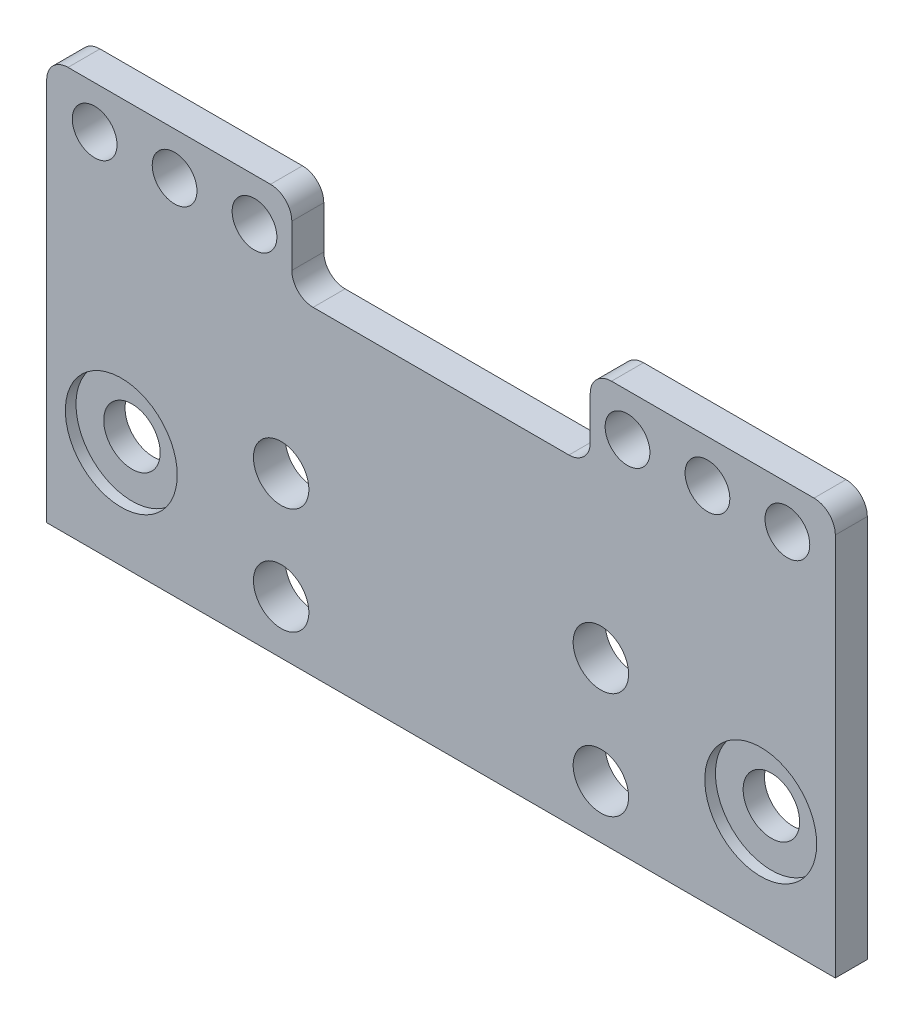
from build123d import *

# Parameters (mm, degrees)
SKETCH_1_R          = 2.1
SKETCH_1_R_2        = 2.65
SKETCH_1_R_3        = 2.6
EXTRUDE_1_DEPTH     = 3
FILLET_1_R          = 2
SKETCH_2_R          = 5.25
CUT_EXTRUDE_1_DEPTH = 1


with BuildPart() as part:
    # 草图1 → 凸台-拉伸1 (new body)
    with BuildSketch(Plane.XY):
        Polygon((14, 20), (14, 28), (37, 28), (37, -10), (-37, -10), (-37, 28), (-14, 28), (-14, 20), align=None)
        with Locations((17.5, 24)):
            Circle(SKETCH_1_R, mode=Mode.SUBTRACT)
        with Locations((25, 24)):
            Circle(SKETCH_1_R, mode=Mode.SUBTRACT)
        with Locations((32.5, 24)):
            Circle(SKETCH_1_R, mode=Mode.SUBTRACT)
        with Locations(Location((-32.5, 24, 0), (0, 0, 180))):
            Circle(SKETCH_1_R, mode=Mode.SUBTRACT)
        with Locations(Location((-17.5, 24, 0), (0, 0, 180))):
            Circle(SKETCH_1_R, mode=Mode.SUBTRACT)
        with Locations(Location((-25, 24, 0), (0, 0, 180))):
            Circle(SKETCH_1_R, mode=Mode.SUBTRACT)
        with Locations((30, 0)):
            Circle(SKETCH_1_R_2, mode=Mode.SUBTRACT)
        with Locations((-30, 0)):
            Circle(SKETCH_1_R_2, mode=Mode.SUBTRACT)
        with Locations((15, 5)):
            Circle(SKETCH_1_R_3, mode=Mode.SUBTRACT)
        with Locations((15, -5)):
            Circle(SKETCH_1_R_3, mode=Mode.SUBTRACT)
        with Locations(Location((-15, 5, 0), (0, 0, 180))):
            Circle(SKETCH_1_R_3, mode=Mode.SUBTRACT)
        with Locations(Location((-15, -5, 0), (0, 0, 180))):
            Circle(SKETCH_1_R_3, mode=Mode.SUBTRACT)
    extrude(amount=EXTRUDE_1_DEPTH)

    # 圆角1
    fillet_1_edges = [part.edges().sort_by_distance(p)[0] for p in [
        (14, 20, 1.5),
        (14, 28, 1.5),
        (37, 28, 1.5),
        (-37, 28, 1.5),
        (-14, 28, 1.5),
        (-14, 20, 1.5),
    ]]
    fillet(fillet_1_edges, radius=FILLET_1_R)

    # 草图2 → 切除-拉伸1 (cut)
    with BuildSketch(Plane.XY.offset(3)):
        with Locations((30, 0)):
            Circle(SKETCH_2_R)
        with Locations((-30, 0)):
            Circle(SKETCH_2_R)
    extrude(amount=-CUT_EXTRUDE_1_DEPTH, mode=Mode.SUBTRACT)


solid = part.part
